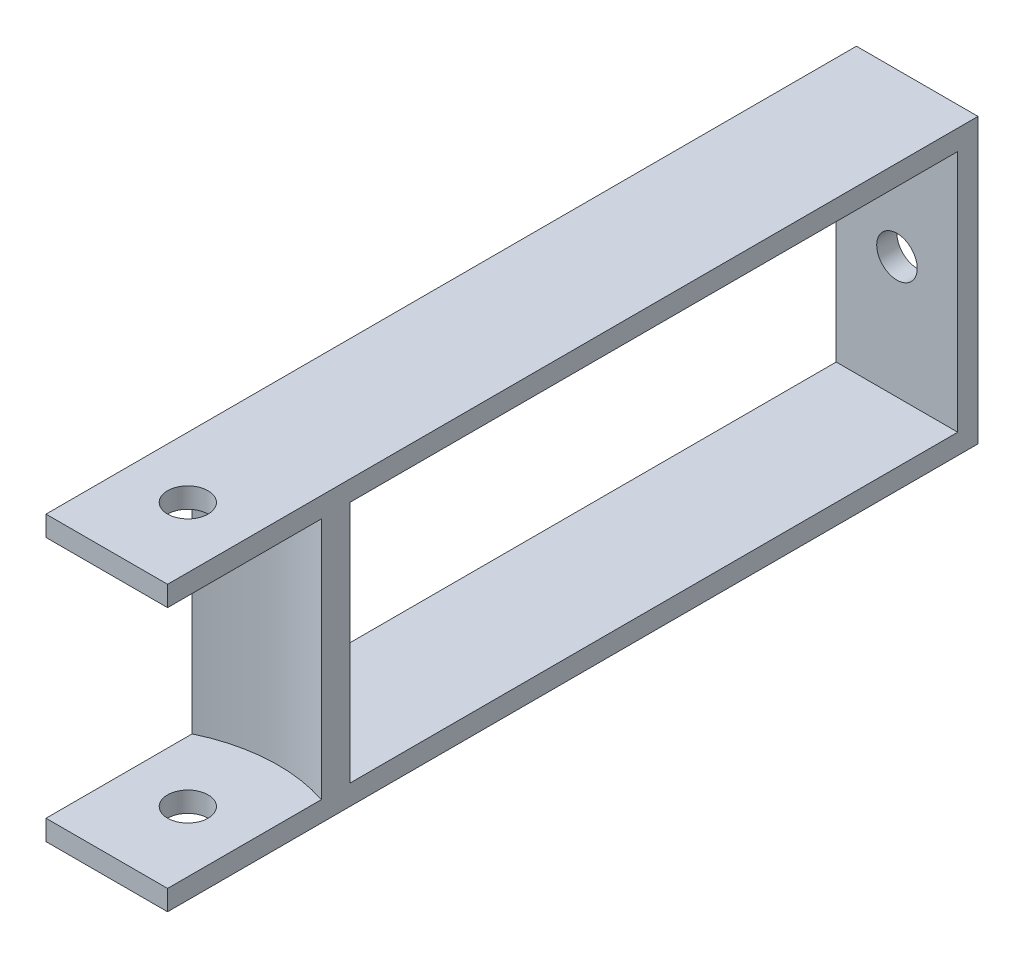
from build123d import *

# Parameters (mm, degrees)
CROQUIS1_W                 = 30
CROQUIS1_H                 = 70
SALIENTE_EXTRUIR1_DEPTH    = 200
CROQUIS5_R                 = 5
CORTAR_EXTRUIR2_DEPTH      = 20
CORTAR_EXTRUIR3_DEPTH      = 30
CORTAR_EXTRUIR3_DEPTH_BACK = 30
CROQUIS6_R                 = 40
CROQUIS7_W                 = 150
CROQUIS7_H                 = 60
CORTAR_EXTRUIR4_DEPTH      = 208.923327371
CROQUIS8_R                 = 5
CORTAR_EXTRUIR5_DEPTH      = 213.832138987


with BuildPart() as part:
    # Croquis1 → Saliente-Extruir1 (new body)
    with BuildSketch(Plane.XY):
        with Locations((4.937888199, 13.291925466)):
            Rectangle(CROQUIS1_W, CROQUIS1_H)
    extrude(amount=SALIENTE_EXTRUIR1_DEPTH)

    # Croquis5 → Cortar-Extruir2 (cut)
    with BuildSketch(Plane(origin=(0, 0, 0), x_dir=(-1, 0, 0), z_dir=(0, 0, -1))):
        with Locations((-4.937888199, 13.291925466)):
            Circle(CROQUIS5_R)
    extrude(amount=-CORTAR_EXTRUIR2_DEPTH, mode=Mode.SUBTRACT)

    # Croquis6 → Cortar-Extruir3 (cut, two sides: drawn at the far end of the back side and taken through both)
    with BuildSketch(Plane(origin=(0, 13.291925466, 0), x_dir=(-1, 0, 0), z_dir=(0, -1, 0)).offset(-CORTAR_EXTRUIR3_DEPTH_BACK)):
        with Locations((-7.25559109, -200)):
            Circle(CROQUIS6_R)
    extrude(amount=CORTAR_EXTRUIR3_DEPTH + CORTAR_EXTRUIR3_DEPTH_BACK, mode=Mode.SUBTRACT)

    # Croquis7 → Cortar-Extruir4 (cut, through all)
    with BuildSketch(Plane.ZY.offset(10.062111801)):
        with Locations((80, 13.291925466)):
            Rectangle(CROQUIS7_W, CROQUIS7_H)
    extrude(amount=-CORTAR_EXTRUIR4_DEPTH, mode=Mode.SUBTRACT)

    # Croquis8 → Cortar-Extruir5 (cut, through all)
    with BuildSketch(Plane(origin=(0, -21.708074534, 0), x_dir=(-1, 0, 0), z_dir=(0, -1, 0))):
        with Locations((-4.937888199, -180)):
            Circle(CROQUIS8_R)
    extrude(amount=-CORTAR_EXTRUIR5_DEPTH, mode=Mode.SUBTRACT)


solid = part.part
